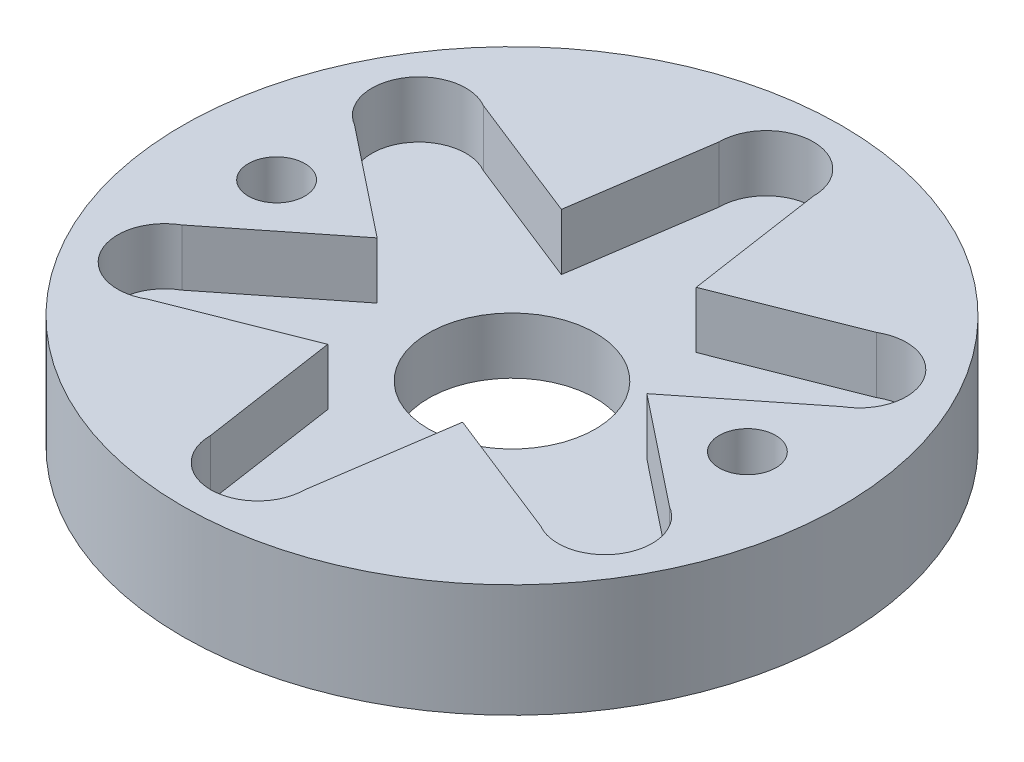
from build123d import *

# Parameters (mm, degrees)
SKETCH1_R           = 17.5
BOSS_EXTRUDE3_DEPTH = 6
SKETCH1_11_R        = 4.425
BOSS_EXTRUDE5_DEPTH = 3
SKETCH2_R           = 1.5
CUT_EXTRUDE1_DEPTH  = 10
SKETCH3_R           = 3
CUT_EXTRUDE2_DEPTH  = 1.5


with BuildPart() as part:
    # Sketch1 → Boss-Extrude3 (new body)
    with BuildSketch(Plane(origin=(0, 0, 0), x_dir=(1, 0, 0), z_dir=(0, 1, 0))):
        Circle(SKETCH1_R)
        with BuildLine():
            ThreePointArc((-2.5, 13.5), (-1.767766953, 15.267766953), (0, 16))
            ThreePointArc((0, 16), (1.767766953, 15.267766953), (2.5, 13.5))
            Line((2.5, 13.5), (3.581091494, 6.202632414))
            Line((3.581091494, 6.202632414), (10.441342951, 8.915063509))
            ThreePointArc((10.441342951, 8.915063509), (12.338390564, 9.164814566), (13.856406461, 8))
            ThreePointArc((13.856406461, 8), (14.106157517, 7.397047613), (14.191342951, 6.75))
            ThreePointArc((14.191342951, 6.75), (13.856406461, 5.5), (12.941342951, 4.584936491))
            Line((12.941342951, 4.584936491), (7.162182988, 0))
            Line((7.162182988, 0), (12.941342951, -4.584936491))
            ThreePointArc((12.941342951, -4.584936491), (13.856406461, -5.5), (14.191342951, -6.75))
            ThreePointArc((14.191342951, -6.75), (14.106157517, -7.397047613), (13.856406461, -8))
            ThreePointArc((13.856406461, -8), (12.338390564, -9.164814566), (10.441342951, -8.915063509))
            Line((10.441342951, -8.915063509), (3.581091494, -6.202632414))
            Line((3.581091494, -6.202632414), (2.5, -13.5))
            ThreePointArc((2.5, -13.5), (1.767766953, -15.267766953), (0, -16))
            ThreePointArc((0, -16), (-1.767766953, -15.267766953), (-2.5, -13.5))
            Line((-2.5, -13.5), (-3.581091494, -6.202632414))
            Line((-3.581091494, -6.202632414), (-10.441342951, -8.915063509))
            ThreePointArc((-10.441342951, -8.915063509), (-12.338390564, -9.164814566), (-13.856406461, -8))
            ThreePointArc((-13.856406461, -8), (-14.106157517, -6.102952387), (-12.941342951, -4.584936491))
            Line((-12.941342951, -4.584936491), (-7.162182988, 0))
            Line((-7.162182988, 0), (-12.941342951, 4.584936491))
            ThreePointArc((-12.941342951, 4.584936491), (-14.106157517, 6.102952387), (-13.856406461, 8))
            ThreePointArc((-13.856406461, 8), (-12.338390564, 9.164814566), (-10.441342951, 8.915063509))
            Line((-10.441342951, 8.915063509), (-3.581091494, 6.202632414))
            Line((-3.581091494, 6.202632414), (-2.5, 13.5))
        make_face(mode=Mode.SUBTRACT)
    extrude(amount=BOSS_EXTRUDE3_DEPTH)

    # Sketch1<11> → Boss-Extrude5 (add)
    with BuildSketch(Plane(origin=(0, 0, 0), x_dir=(1, 0, 0), z_dir=(0, 1, 0))):
        with BuildLine():
            Line((-2.5, 13.5), (-3.581091494, 6.202632414))
            Line((-3.581091494, 6.202632414), (-10.441342951, 8.915063509))
            ThreePointArc((-10.441342951, 8.915063509), (-13.856406461, 8), (-12.941342951, 4.584936491))
            Line((-12.941342951, 4.584936491), (-7.162182988, 0))
            Line((-7.162182988, 0), (-12.941342951, -4.584936491))
            ThreePointArc((-12.941342951, -4.584936491), (-13.856406461, -8), (-10.441342951, -8.915063509))
            Line((-10.441342951, -8.915063509), (-3.581091494, -6.202632414))
            Line((-3.581091494, -6.202632414), (-2.5, -13.5))
            ThreePointArc((-2.5, -13.5), (0, -16), (2.5, -13.5))
            Line((2.5, -13.5), (3.581091494, -6.202632414))
            Line((3.581091494, -6.202632414), (10.441342951, -8.915063509))
            ThreePointArc((10.441342951, -8.915063509), (13.856406461, -8), (12.941342951, -4.584936491))
            Line((12.941342951, -4.584936491), (7.162182988, 0))
            Line((7.162182988, 0), (12.941342951, 4.584936491))
            ThreePointArc((12.941342951, 4.584936491), (13.856406461, 8), (10.441342951, 8.915063509))
            Line((10.441342951, 8.915063509), (3.581091494, 6.202632414))
            Line((3.581091494, 6.202632414), (2.5, 13.5))
            ThreePointArc((2.5, 13.5), (0, 16), (-2.5, 13.5))
        make_face()
        Circle(SKETCH1_11_R, mode=Mode.SUBTRACT)
    extrude(amount=BOSS_EXTRUDE5_DEPTH)

    # Sketch2 → Cut-Extrude1 (cut)
    with BuildSketch(Plane(origin=(0, 6, 0), x_dir=(1, 0, 0), z_dir=(0, 1, 0))):
        with Locations((-12.5, 0)):
            Circle(SKETCH2_R)
        with Locations((12.5, 0)):
            Circle(SKETCH2_R)
    extrude(amount=-CUT_EXTRUDE1_DEPTH, mode=Mode.SUBTRACT)

    # Sketch3 → Cut-Extrude2 (cut)
    with BuildSketch(Plane.XZ):
        with Locations((-12.5, 0)):
            Circle(SKETCH3_R)
        with Locations((12.5, 0)):
            Circle(SKETCH3_R)
    extrude(amount=-CUT_EXTRUDE2_DEPTH, mode=Mode.SUBTRACT)


solid = part.part
